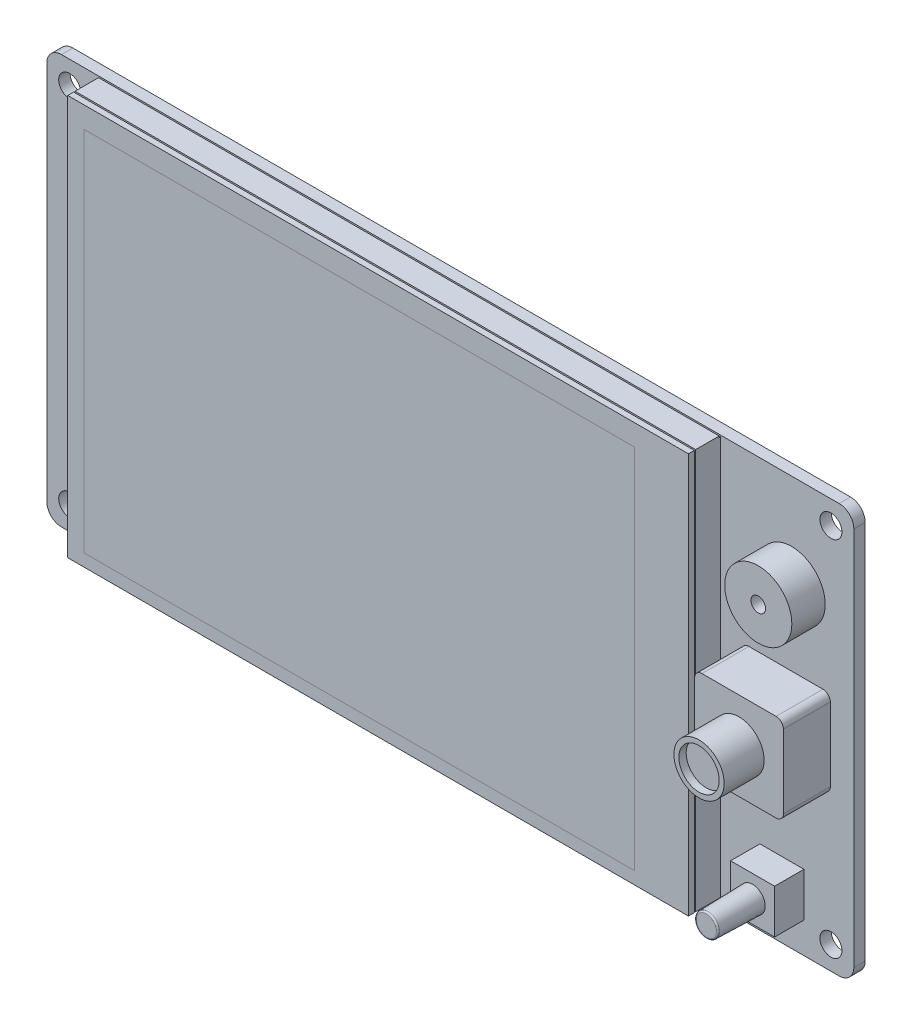
from build123d import *

# Parameters (mm, degrees)
SKETCH1_R            = 1.5
BOSS_EXTRUDE1_DEPTH  = 1.55
SKETCH3_W            = 14
SKETCH3_H            = 14
BOSS_EXTRUDE2_DEPTH  = 1.55
CUT_EXTRUDE1_REACH   = 63.684
BOSS_EXTRUDE3_DEPTH  = 3.15
SKETCH3_4_W          = 5
SKETCH3_4_H          = 25
BOSS_EXTRUDE4_DEPTH  = 2
SKETCH3_5_W          = 5
SKETCH3_5_H          = 10.5
BOSS_EXTRUDE5_DEPTH  = 8.9
SKETCH3_6_W          = 6.6
SKETCH3_6_H          = 6
BOSS_EXTRUDE6_DEPTH  = 2.25
SKETCH3_7_W          = 10
SKETCH3_7_H          = 4.3
BOSS_EXTRUDE7_DEPTH  = 1.55
SKETCH5_W            = 81.6
SKETCH5_H            = 54.57
BOSS_EXTRUDE8_DEPTH  = 3.6
SKETCH5_3_W          = 1.5
SKETCH5_3_H          = 54.57
BOSS_EXTRUDE9_DEPTH  = 3.4
SKETCH6_W            = 84.6
SKETCH6_H            = 54.57
BOSS_EXTRUDE10_DEPTH = 0.8
SKETCH5_4_W          = 6
SKETCH5_4_H          = 6
BOSS_EXTRUDE11_DEPTH = 4
SKETCH5_5_W          = 12.1
SKETCH5_5_H          = 12
BOSS_EXTRUDE12_DEPTH = 6.4
SKETCH5_6_R          = 4.575
BOSS_EXTRUDE13_DEPTH = 4.55
SKETCH7_R            = 1
CUT_EXTRUDE2_DEPTH   = 3
SKETCH8_R            = 3.425
BOSS_EXTRUDE14_DEPTH = 5.45
SKETCH10_R           = 1.575
SKETCH9_R            = 1.725
FILLET1_R            = 0.2
SKETCH11_W           = 2.8
SKETCH11_H           = 23.97
CUT_EXTRUDE3_DEPTH   = 12.5
FILLET2_R            = 1
SKETCH13_W           = 84.6
SKETCH13_H           = 0.2
SKETCH13_W_2         = 81.6
CUT_EXTRUDE4_DEPTH   = 0.2
SKETCH14_W           = 81.6
SKETCH14_H           = 0.2
CUT_EXTRUDE5_DEPTH   = 0.2
SKETCH15_R           = 2.75
CUT_EXTRUDE6_DEPTH   = 1


with BuildPart() as part:
    # Sketch1 → Boss-Extrude1 (new body)
    with BuildSketch(Plane.XY):
        with BuildLine():
            Line((-53, 27.885), (53, 27.885))
            ThreePointArc((53, 27.885), (54.414213562, 27.299213562), (55, 25.885))
            Line((55, 25.885), (55, -25.885))
            ThreePointArc((55, -25.885), (54.414213562, -27.299213562), (53, -27.885))
            Line((53, -27.885), (-53, -27.885))
            ThreePointArc((-53, -27.885), (-54.414213562, -27.299213562), (-55, -25.885))
            Line((-55, -25.885), (-55, 25.885))
            ThreePointArc((-55, 25.885), (-54.414213562, 27.299213562), (-53, 27.885))
        make_face()
        with Locations(Location((-51.88, 24.715, 0), (0, 0, 180))):
            Circle(SKETCH1_R, mode=Mode.SUBTRACT)
        with Locations(Location((51.88, 24.715, 0), (0, 0, 180))):
            Circle(SKETCH1_R, mode=Mode.SUBTRACT)
        with Locations(Location((51.88, -24.715, 0), (0, 0, 180))):
            Circle(SKETCH1_R, mode=Mode.SUBTRACT)
        with Locations(Location((-51.88, -24.715, 0), (0, 0, 180))):
            Circle(SKETCH1_R, mode=Mode.SUBTRACT)
    extrude(amount=BOSS_EXTRUDE1_DEPTH)

    # Sketch3 → Boss-Extrude2 (add)
    with BuildSketch(Plane(origin=(0, 0, 0), x_dir=(-1, 0, 0), z_dir=(0, 0, -1))):
        with Locations((22, 3.885)):
            Rectangle(SKETCH3_W, SKETCH3_H)
    extrude(amount=BOSS_EXTRUDE2_DEPTH)

    # Sketch4 → Cut-Extrude1 (cut, up to next)
    with BuildSketch(Plane(origin=(0, 0, 0), x_dir=(-1, 0, 0), z_dir=(0, 0, -1)), mode=Mode.PRIVATE) as cut_extrude1_sk1:
        with BuildLine():
            Line((-10.6, 9.735), (-10.6, -9.965))
            ThreePointArc((-10.6, -9.965), (-11.75, -11.115), (-12.9, -9.965))
            Line((-12.9, -9.965), (-12.9, 9.735))
            ThreePointArc((-12.9, 9.735), (-11.75, 10.885), (-10.6, 9.735))
        make_face()
    cut_extrude1_tool1 = extrude(cut_extrude1_sk1.sketch, amount=-CUT_EXTRUDE1_REACH, mode=Mode.PRIVATE) & part.part
    add(cut_extrude1_tool1.solids().sort_by_distance((11.75, -0.115, 0))[0], mode=Mode.SUBTRACT)

    # Sketch3<3> → Boss-Extrude3 (add)
    with BuildSketch(Plane(origin=(0, 0, 0), x_dir=(-1, 0, 0), z_dir=(0, 0, -1))):
        Polygon((43.7, 11.665), (46.3, 14.265), (54.6, 14.265), (54.6, -12.685), (38, -12.685), (38, 11.665), align=None)
    extrude(amount=BOSS_EXTRUDE3_DEPTH)

    # Sketch3<4> → Boss-Extrude4 (add)
    with BuildSketch(Plane(origin=(0, 0, 0), x_dir=(-1, 0, 0), z_dir=(0, 0, -1))):
        with Locations((4.1, 0.415)):
            Rectangle(SKETCH3_4_W, SKETCH3_4_H)
    extrude(amount=BOSS_EXTRUDE4_DEPTH)

    # Sketch3<5> → Boss-Extrude5 (add)
    with BuildSketch(Plane(origin=(0, 0, 0), x_dir=(-1, 0, 0), z_dir=(0, 0, -1))):
        with Locations((-32.4, 1.335)):
            Rectangle(SKETCH3_5_W, SKETCH3_5_H)
    extrude(amount=BOSS_EXTRUDE5_DEPTH)

    # Sketch3<6> → Boss-Extrude6 (add)
    with BuildSketch(Plane(origin=(0, 0, 0), x_dir=(-1, 0, 0), z_dir=(0, 0, -1))):
        with Locations((-18.55, 1.885)):
            Rectangle(SKETCH3_6_W, SKETCH3_6_H)
    extrude(amount=BOSS_EXTRUDE6_DEPTH)

    # Sketch3<7> → Boss-Extrude7 (add)
    with BuildSketch(Plane(origin=(0, 0, 0), x_dir=(-1, 0, 0), z_dir=(0, 0, -1))):
        with Locations((42.8, -23.035)):
            Rectangle(SKETCH3_7_W, SKETCH3_7_H)
    extrude(amount=BOSS_EXTRUDE7_DEPTH)

    # Sketch5 → Boss-Extrude8 (add)
    # profile 1 of 2: a face of its own
    with BuildSketch(Plane.XY.offset(1.55)):
        with Locations((-5.45, 0.6)):
            Rectangle(SKETCH5_W, SKETCH5_H)
        with BuildLine():
            Line((10.6, -9.965), (10.6, 9.735))
            ThreePointArc((10.6, 9.735), (11.75, 10.885), (12.9, 9.735))
            Line((12.9, 9.735), (12.9, -9.965))
            ThreePointArc((12.9, -9.965), (11.75, -11.115), (10.6, -9.965))
        make_face(mode=Mode.SUBTRACT)
    # profile 2 of 2: a face of its own
    with BuildSketch(Plane.XY.offset(1.55)):
        with BuildLine():
            ThreePointArc((10.6, 9.735), (11.75, 10.885), (12.9, 9.735))
            Line((12.9, 9.735), (12.9, -9.965))
            ThreePointArc((12.9, -9.965), (11.75, -11.115), (10.6, -9.965))
            Line((10.6, -9.965), (10.6, 9.735))
        make_face()
    extrude(amount=BOSS_EXTRUDE8_DEPTH)

    # Sketch5<3> → Boss-Extrude9 (add)
    with BuildSketch(Plane.XY.offset(1.55)):
        with Locations((-47, 0.6)):
            Rectangle(SKETCH5_3_W, SKETCH5_3_H)
        with Locations((36.1, 0.6)):
            Rectangle(SKETCH5_3_W, SKETCH5_3_H)
    extrude(amount=BOSS_EXTRUDE9_DEPTH)

    # Sketch6 → Boss-Extrude10 (add)
    with BuildSketch(Plane.XY.offset(5.15)):
        with Locations((-5.45, 0.6)):
            Rectangle(SKETCH6_W, SKETCH6_H)
    extrude(amount=BOSS_EXTRUDE10_DEPTH)

    # Sketch5<4> → Boss-Extrude11 (add)
    with BuildSketch(Plane.XY.offset(1.55)):
        with Locations((45.2, -20.685)):
            Rectangle(SKETCH5_4_W, SKETCH5_4_H)
    extrude(amount=BOSS_EXTRUDE11_DEPTH)

    # Sketch5<5> → Boss-Extrude12 (add)
    with BuildSketch(Plane.XY.offset(1.55)):
        with Locations((45.75, -1.135)):
            Rectangle(SKETCH5_5_W, SKETCH5_5_H)
    extrude(amount=BOSS_EXTRUDE12_DEPTH)

    # Sketch5<6> → Boss-Extrude13 (add)
    with BuildSketch(Plane.XY.offset(1.55)):
        with Locations((46.525, 15.01)):
            Circle(SKETCH5_6_R)
    extrude(amount=BOSS_EXTRUDE13_DEPTH)

    # Sketch7 → Cut-Extrude2 (cut)
    with BuildSketch(Plane.XY.offset(6.1)):
        with Locations((46.525, 15.01)):
            Circle(SKETCH7_R)
    extrude(amount=-CUT_EXTRUDE2_DEPTH, mode=Mode.SUBTRACT)

    # Sketch8 → Boss-Extrude14 (add)
    with BuildSketch(Plane.XY.offset(7.95)):
        with Locations((45.75, -1.135)):
            Circle(SKETCH8_R)
    extrude(amount=BOSS_EXTRUDE14_DEPTH)

    # Sketch10 → Loft1 section 0
    with BuildSketch(Plane.XY.offset(11.85)):
        with Locations((45.2, -20.685)):
            Circle(SKETCH10_R)
    # Sketch9 → Loft1 section 1
    with BuildSketch(Plane.XY.offset(5.55)):
        with Locations((45.2, -20.685)):
            Circle(SKETCH9_R)
    loft()

    # Fillet1
    fillet1_edges = [part.edges().sort_by_distance(p)[0] for p in [
        (43.625, -20.685, 11.85),
    ]]
    fillet(fillet1_edges, radius=FILLET1_R)

    # Sketch11 → Cut-Extrude3 (cut)
    with BuildSketch(Plane.ZY.offset(54.6)):
        with Locations((-1.45, 1.1)):
            Rectangle(SKETCH11_W, SKETCH11_H)
    extrude(amount=-CUT_EXTRUDE3_DEPTH, mode=Mode.SUBTRACT)

    # Fillet2
    fillet2_edges = [part.edges().sort_by_distance(p)[0] for p in [
        (51.8, -7.135, 4.75),
        (51.8, 4.865, 4.75),
        (39.7, 4.865, 4.75),
        (39.7, -7.135, 4.75),
    ]]
    fillet(fillet2_edges, radius=FILLET2_R)

    # Sketch13 → Cut-Extrude4 (cut)
    with BuildSketch(Plane(origin=(0, 27.885, 0), x_dir=(1, 0, 0), z_dir=(0, 1, 0))):
        with Locations((-5.45, -1.65)):
            Rectangle(SKETCH13_W, SKETCH13_H)
        with Locations((-5.45, -5.05)):
            Rectangle(SKETCH13_W_2, SKETCH13_H)
    extrude(amount=-CUT_EXTRUDE4_DEPTH, mode=Mode.SUBTRACT)

    # Sketch14 → Cut-Extrude5 (cut)
    with BuildSketch(Plane.XZ.offset(26.685)):
        with Locations((-5.45, 5.05)):
            Rectangle(SKETCH14_W, SKETCH14_H)
    extrude(amount=-CUT_EXTRUDE5_DEPTH, mode=Mode.SUBTRACT)

    # Sketch15 → Cut-Extrude6 (cut)
    with BuildSketch(Plane.XY.offset(13.4)):
        with Locations((45.75, -1.135)):
            Circle(SKETCH15_R)
    extrude(amount=-CUT_EXTRUDE6_DEPTH, mode=Mode.SUBTRACT)


solid = part.part
